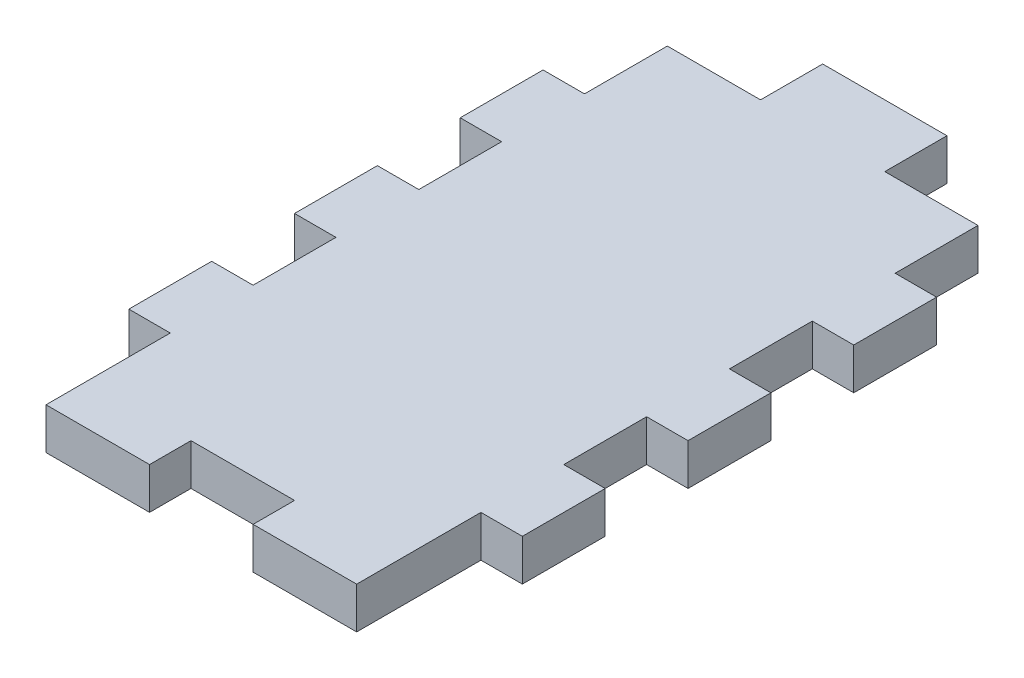
from build123d import *

# Parameters (mm, degrees)
BOSS_EXTRUDE2_DEPTH = 4


with BuildPart() as part:
    # Sketch1 → Boss-Extrude2 (new body)
    with BuildSketch(Plane(origin=(0, 0, 0), x_dir=(1, 0, 0), z_dir=(0, 1, 0))):
        Polygon((-15, 30), (-15, 22), (-19, 22), (-19, 14), (-15, 14), (-15, 6), (-19, 6), (-19, -2), (-15, -2), (-15, -10), (-19, -10), (-19, -18), (-15, -18), (-15, -26), (-15, -30), (-5, -30), (-5, -26), (5, -26), (5, -30), (15, -30), (15, -26), (15, -18), (19, -18), (19, -10), (15, -10), (15, -2), (19, -2), (19, 6), (15, 6), (15, 14), (19, 14), (19, 22), (15, 22), (15, 30), (6, 30), (6, 36), (-6, 36), (-6, 30), align=None)
    extrude(amount=BOSS_EXTRUDE2_DEPTH)


solid = part.part
